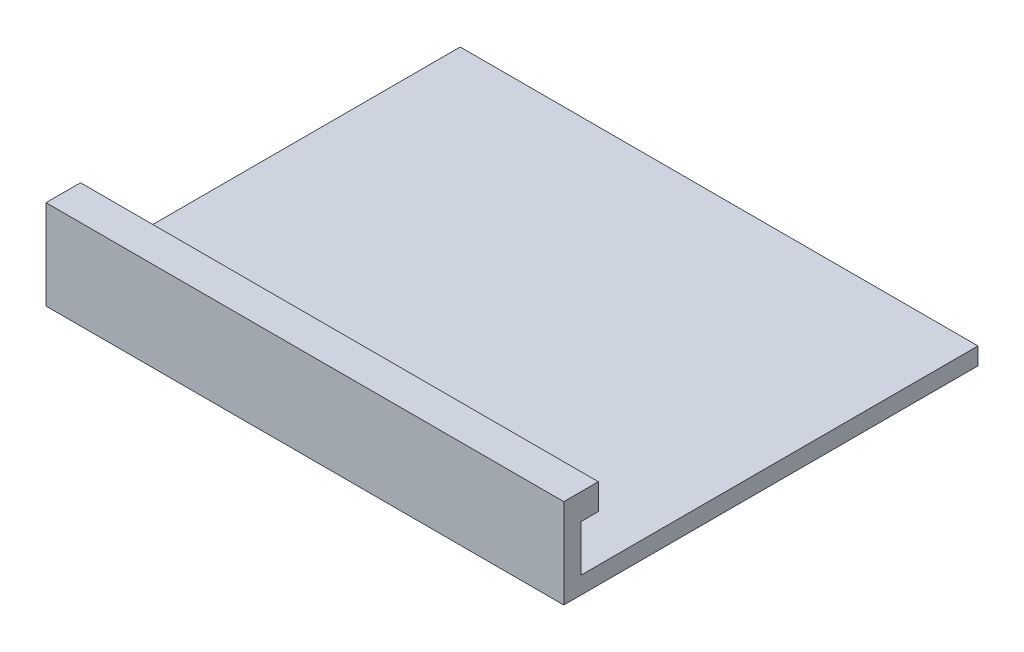
from build123d import *

# Parameters (mm, degrees)
BOSS_EXTRUDE1_DEPTH = 762


with BuildPart() as part:
    # Sketch1 → Boss-Extrude1 (new body)
    with BuildSketch(Plane(origin=(0, 0, 0), x_dir=(0, 0, -1), z_dir=(1, 0, 0))):
        Polygon((-584.2, 93.6625), (-584.2, 25.4), (0, 25.4), (0, 0), (-609.6, 0), (-609.6, 131.7625), (-558.8, 131.7625), (-558.8, 93.6625), align=None)
    extrude(amount=BOSS_EXTRUDE1_DEPTH)


solid = part.part
